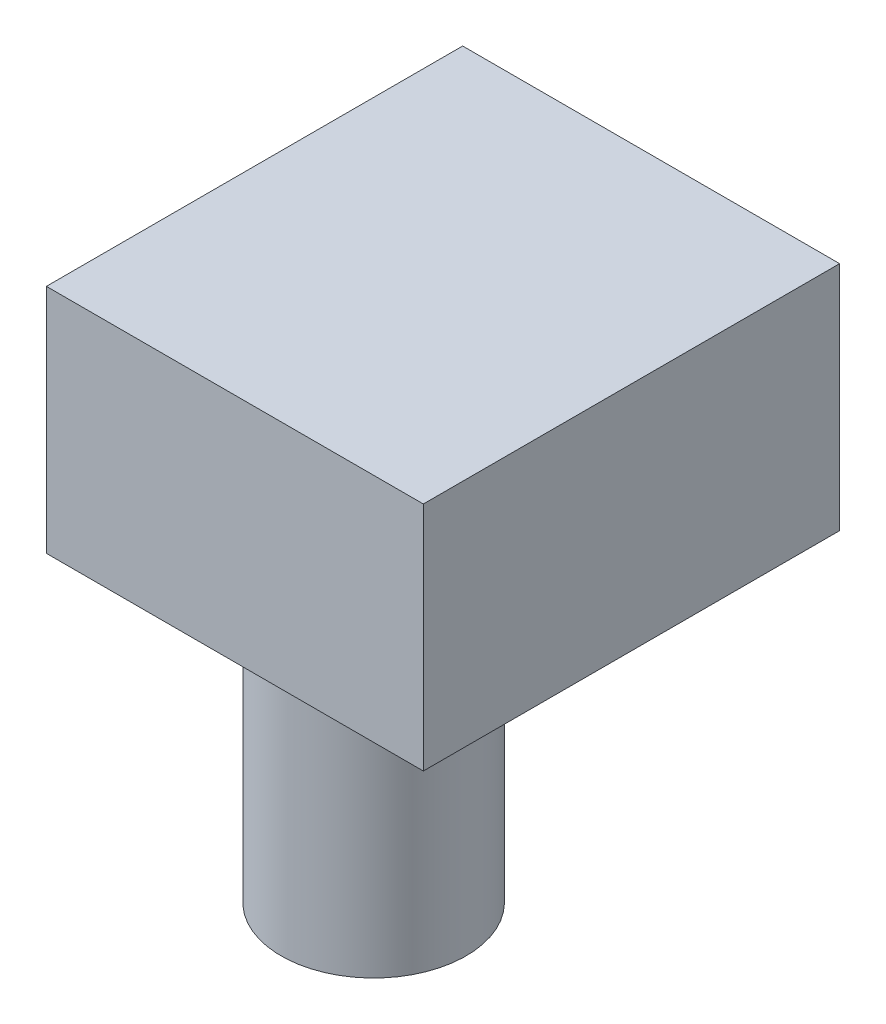
from build123d import *

# Parameters (mm, degrees)
SKETCH_1_W      = 16.3
SKETCH_1_H      = 18
EXTRUDE_1_DEPTH = 10
SKETCH_3_R      = 4
EXTRUDE_2_DEPTH = 12


with BuildPart() as part:
    # Эскиз1 → Бобышка-Вытянуть1 (new body)
    with BuildSketch(Plane(origin=(0, 0, 0), x_dir=(1, 0, 0), z_dir=(0, 1, 0))):
        with Locations((8.15, 9)):
            Rectangle(SKETCH_1_W, SKETCH_1_H)
    extrude(amount=EXTRUDE_1_DEPTH)

    # Эскиз3 → Бобышка-Вытянуть2 (add)
    with BuildSketch(Plane.XZ):
        with Locations(Location((8.15, -6, 0), (0, 0, 270))):
            Circle(SKETCH_3_R)
    extrude(amount=EXTRUDE_2_DEPTH)


solid = part.part
